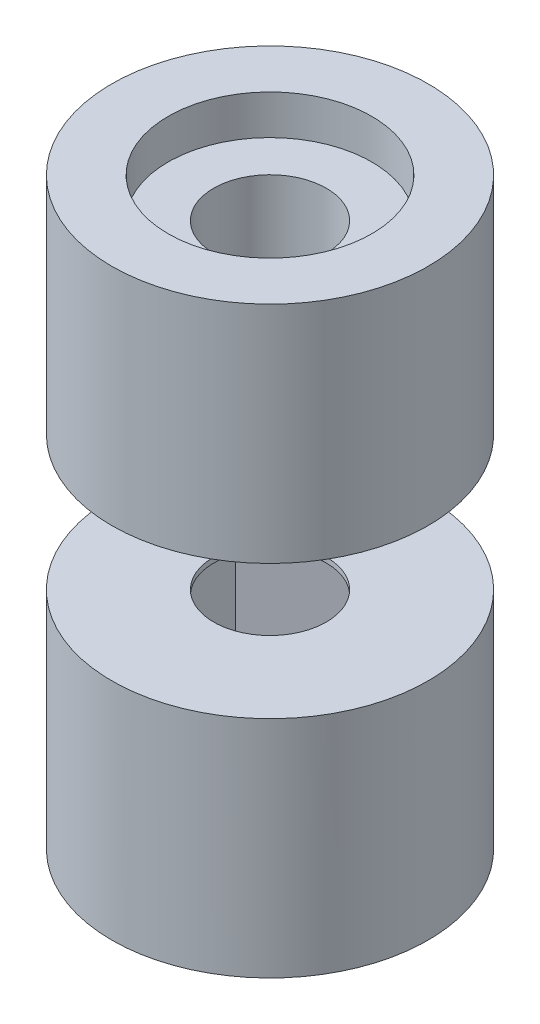
from build123d import *

# Parameters (mm, degrees)
SKETCH1_R               = 8
BOSS_EXTRUDE1_DEPTH     = 29.524
CUT_EXTRUDE1_DEPTH      = 32.617504266
CUT_EXTRUDE1_DEPTH_BACK = 32.617504266
SKETCH2_W               = 20.4
SKETCH2_H               = 6.8
SKETCH3_R               = 2.85
CUT_EXTRUDE2_DEPTH      = 29.524
SKETCH4_R               = 5.15
CUT_EXTRUDE3_DEPTH      = 2
CUT_EXTRUDE4_DEPTH      = 11.1


with BuildPart() as part:
    # Sketch1 → Boss-Extrude1 (new body)
    with BuildSketch(Plane(origin=(0, 0, 0), x_dir=(1, 0, 0), z_dir=(0, 1, 0))):
        with Locations(Location((0, 0, 0), (0, 0, 270))):
            Circle(SKETCH1_R)
    extrude(amount=BOSS_EXTRUDE1_DEPTH)

    # Sketch2 → Cut-Extrude1 (cut, two sides: drawn at the far end of the back side and taken through both)
    with BuildSketch(Plane.XY.offset(-CUT_EXTRUDE1_DEPTH_BACK)):
        with Locations((0, 14.762)):
            Rectangle(SKETCH2_W, SKETCH2_H)
    extrude(amount=CUT_EXTRUDE1_DEPTH + CUT_EXTRUDE1_DEPTH_BACK, mode=Mode.SUBTRACT)


with BuildPart() as cut_extrude1_piece_1:
    # of the separate pieces the step leaves, piece 1, a body of its own (cut_extrude1_pieces)
    add(part.part.solids().sort_by_distance((0, 0, 8))[0])


with BuildPart() as cut_extrude1_piece_2:
    # of the separate pieces the step leaves, piece 2, a body of its own (cut_extrude1_pieces)
    add(part.part.solids().sort_by_distance((0, 18.162, 8))[0])


with BuildPart() as cut_extrude2_tool:
    # Sketch3 → Cut-Extrude2 (new body)
    with BuildSketch(Plane(origin=(0, 0, 0), x_dir=(1, 0, 0), z_dir=(0, 1, 0))):
        with Locations(Location((0, 0, 0), (0, 0, 270))):
            Circle(SKETCH3_R)
    extrude(amount=CUT_EXTRUDE2_DEPTH)


with BuildPart() as cut_extrude1_piece_1_1:
    add(cut_extrude1_piece_1.part)

    # Cut-Extrude2: cut by cut_extrude2_tool
    add(cut_extrude2_tool.part, mode=Mode.SUBTRACT)

    # Sketch5 → Cut-Extrude4 (cut)
    with BuildSketch(Plane(origin=(0, 0, 0), x_dir=(1, 0, 0), z_dir=(0, 1, 0))):
        Polygon((4.1, -2.367136104), (0, -4.734272207), (-4.1, -2.367136104), (-4.1, 2.367136104), (0, 4.734272207), (4.1, 2.367136104), align=None)
    extrude(amount=CUT_EXTRUDE4_DEPTH, mode=Mode.SUBTRACT)


with BuildPart() as cut_extrude1_piece_2_1:
    add(cut_extrude1_piece_2.part)

    # Cut-Extrude2: cut by cut_extrude2_tool
    add(cut_extrude2_tool.part, mode=Mode.SUBTRACT)

    # Sketch4 → Cut-Extrude3 (cut)
    with BuildSketch(Plane(origin=(0, 29.524, 0), x_dir=(1, 0, 0), z_dir=(0, 1, 0))):
        with Locations(Location((0, 0, 0), (0, 0, 270))):
            Circle(SKETCH4_R)
    extrude(amount=-CUT_EXTRUDE3_DEPTH, mode=Mode.SUBTRACT)


solid = Compound([cut_extrude1_piece_1_1.part, cut_extrude1_piece_2_1.part])
